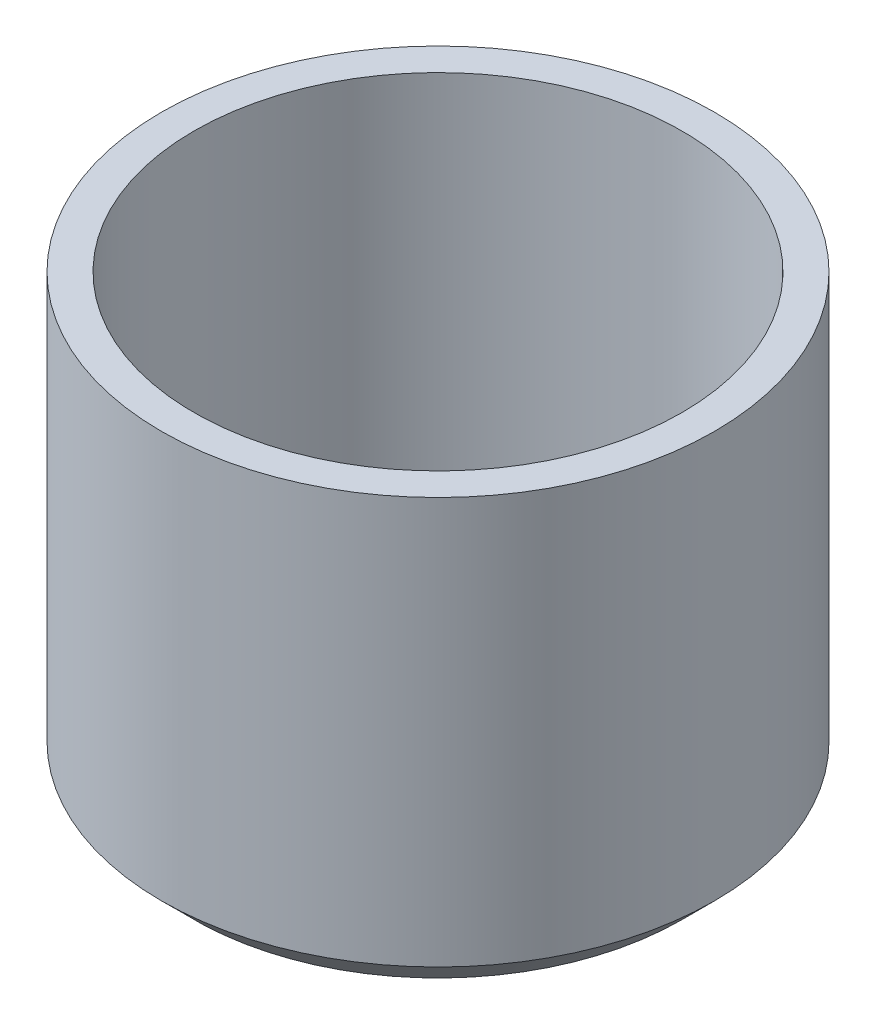
from build123d import *


with BuildPart() as part:
    # Sketch1 → Revolve1 (revolve)
    with BuildSketch(Plane.XY, mode=Mode.PRIVATE) as revolve1_sk:
        Polygon((0, 0), (-9, 0), (-10.2, 1.2), (-10.2, 16.2), (-9, 16.2), (-9, 1.697056275), (-8.502943725, 1.2), (0, 1.2), align=None)
    revolve(revolve1_sk.sketch.rotate(Axis((0, -368.040154875, 0), (0, 1, 0)), 180), axis=Axis((0, -368.040154875, 0), (0, 1, 0)))


solid = part.part
